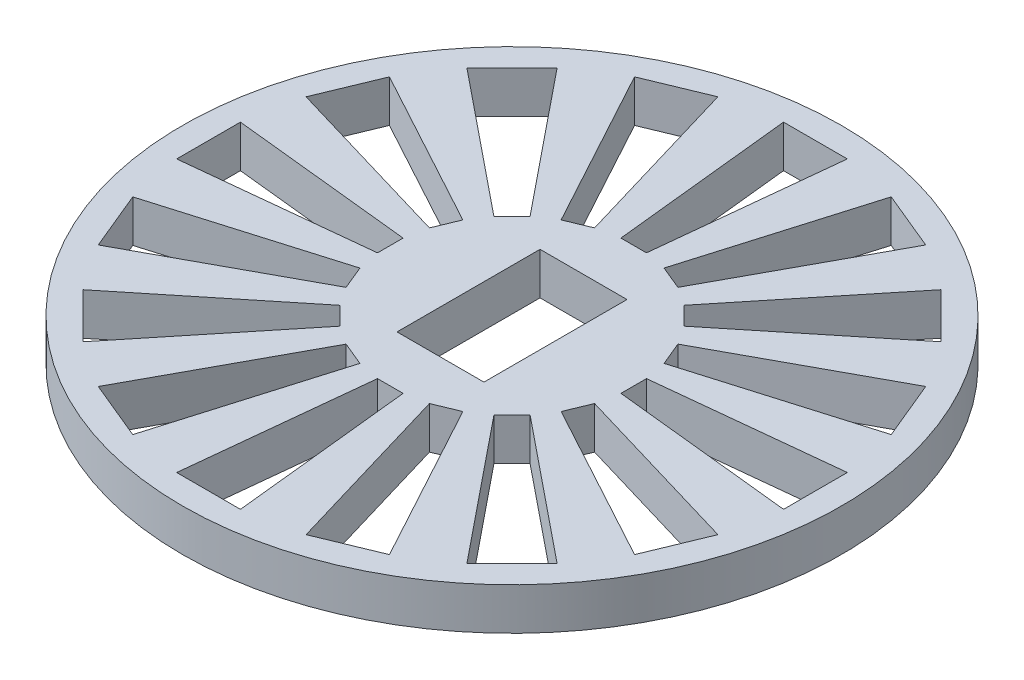
from build123d import *

# Parameters (mm, degrees)
SKETCH1_R           = 11.75
SKETCH1_W           = 3.1
SKETCH1_H           = 5.1
BOSS_EXTRUDE1_DEPTH = 1.5


with BuildPart() as part:
    # Sketch1 (on Top Plane) → Boss-Extrude1 (new body)
    with BuildSketch(Plane(origin=(0, 0, 0), x_dir=(1, 0, 0), z_dir=(0, 1, 0))):
        with Locations(Location((0, 0, 0), (0, 0, 270))):
            Circle(SKETCH1_R)
        Rectangle(SKETCH1_W, SKETCH1_H, mode=Mode.SUBTRACT)
        Polygon((0.455975537, 4.338317439), (1.137082311, 10.81861552), (-1.137082311, 10.81861552), (-0.455975537, 4.338317439), align=None, mode=Mode.SUBTRACT)
        Polygon((2.081681544, 3.833682994), (5.190844864, 9.560049478), (3.089790717, 10.430334601), (1.239148612, 4.182671561), align=None, mode=Mode.SUBTRACT)
        Polygon((3.390522808, 2.745330804), (8.454400744, 6.845978303), (6.846323518, 8.454055528), (2.745676019, 3.390177592), align=None, mode=Mode.SUBTRACT)
        Polygon((4.183240111, 1.238952624), (10.430903151, 3.089594729), (9.560618028, 5.190648876), (3.834251544, 2.081485556), align=None, mode=Mode.SUBTRACT)
        Polygon((4.339149431, -0.456119123), (10.819447512, -1.137225897), (10.819447512, 1.136938725), (4.339149431, 0.455831951), align=None, mode=Mode.SUBTRACT)
        Polygon((3.834514986, -2.08182513), (9.56088147, -5.19098845), (10.431166593, -3.089934303), (4.183503553, -1.239292198), align=None, mode=Mode.SUBTRACT)
        Polygon((2.746162796, -3.390666394), (6.846810295, -8.45454433), (8.45488752, -6.846467104), (3.391009584, -2.745819606), align=None, mode=Mode.SUBTRACT)
        Polygon((1.239784616, -4.183383697), (3.090426721, -10.431046737), (5.191480868, -9.560761614), (2.082317548, -3.83439513), align=None, mode=Mode.SUBTRACT)
        Polygon((-0.455287131, -4.339293017), (-1.136393905, -10.819591098), (1.137770717, -10.819591098), (0.456663943, -4.339293017), align=None, mode=Mode.SUBTRACT)
        Polygon((-2.080993138, -3.834658572), (-5.190156458, -9.561025056), (-3.089102311, -10.431310179), (-1.238460206, -4.183647139), align=None, mode=Mode.SUBTRACT)
        Polygon((-3.389834402, -2.746306382), (-8.453712338, -6.846953881), (-6.845635112, -8.455031106), (-2.744987614, -3.39115317), align=None, mode=Mode.SUBTRACT)
        Polygon((-4.182551705, -1.239928202), (-10.430214745, -3.090570307), (-9.559929622, -5.191624454), (-3.833563138, -2.082461134), align=None, mode=Mode.SUBTRACT)
        Polygon((-4.338461025, 0.455143545), (-10.818759106, 1.136250319), (-10.818759106, -1.137914303), (-4.338461025, -0.456807529), align=None, mode=Mode.SUBTRACT)
        Polygon((-3.83382658, 2.080849552), (-9.560193064, 5.190012872), (-10.430478187, 3.088958725), (-4.182815147, 1.23831662), align=None, mode=Mode.SUBTRACT)
        Polygon((-2.74547439, 3.389690816), (-6.846121889, 8.453568752), (-8.454199114, 6.845491526), (-3.390321178, 2.744844027), align=None, mode=Mode.SUBTRACT)
        Polygon((-1.23909621, 4.182408119), (-3.089738315, 10.430071159), (-5.190792462, 9.559786036), (-2.081629142, 3.833419552), align=None, mode=Mode.SUBTRACT)
    extrude(amount=BOSS_EXTRUDE1_DEPTH)


solid = part.part
